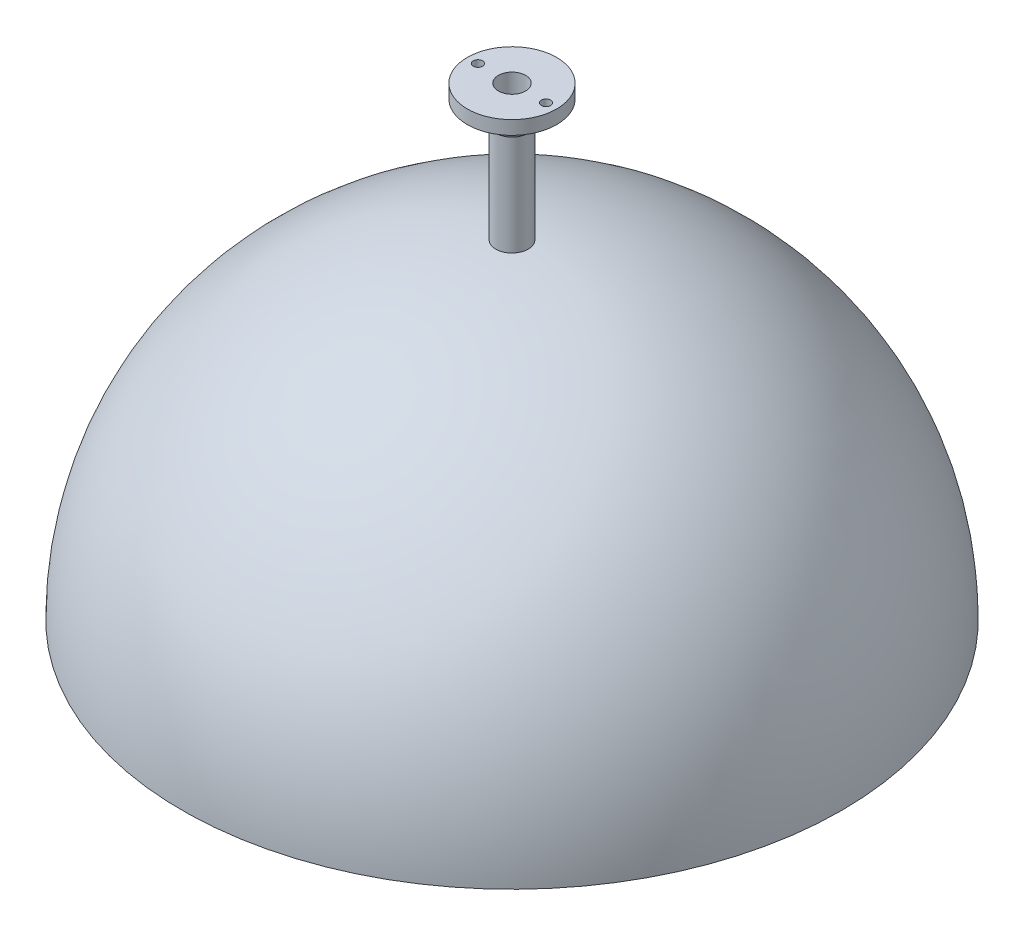
from build123d import *

# Parameters (mm, degrees)
CUT_EXTRUDE1_REACH = 1549.869
SKETCH3_R          = 11
SKETCH4_R          = 32
CUT_EXTRUDE2_DEPTH = 500


with BuildPart() as part:
    # Sketch1 → Revolve1 (revolve)
    with BuildSketch(Plane.XY):
        with BuildLine():
            Line((0, 759), (0, 775))
            ThreePointArc((0, 775), (548.00775542, 548.00775542), (775, 0))
            Line((775, 0), (759, 0))
            ThreePointArc((759, 0), (536.694046921, 536.694046921), (0, 759))
        make_face()
    revolve(axis=Axis((0, 0, 0), (0, 1, 0)))

    # Sketch2 → Revolve2 (revolve)
    with BuildSketch(Plane.XY):
        Polygon((105, 1093), (105, 1061), (52.624014674, 1061), (38, 1010), (38, 774.067826486), (32, 774.067826486), (32, 1093), align=None)
    revolve(axis=Axis((0, 775, 0), (0, 1, 0)))

    # Sketch3 → Cut-Extrude1 (cut, up to next)
    with BuildSketch(Plane(origin=(0, 1093, 0), x_dir=(1, 0, 0), z_dir=(0, 1, 0)), mode=Mode.PRIVATE) as cut_extrude1_sk1:
        with Locations(Location((-80, 0, 0), (0, 0, 180))):
            Circle(SKETCH3_R)
    cut_extrude1_tool1 = extrude(cut_extrude1_sk1.sketch, amount=-CUT_EXTRUDE1_REACH, mode=Mode.PRIVATE) & part.part
    # Sketch3 → Cut-Extrude1 (cut, up to next)
    with BuildSketch(Plane(origin=(0, 1093, 0), x_dir=(1, 0, 0), z_dir=(0, 1, 0)), mode=Mode.PRIVATE) as cut_extrude1_sk2:
        with Locations(Location((80, 0, 0), (0, 0, 180))):
            Circle(SKETCH3_R)
    cut_extrude1_tool2 = extrude(cut_extrude1_sk2.sketch, amount=-CUT_EXTRUDE1_REACH, mode=Mode.PRIVATE) & part.part
    add(cut_extrude1_tool1.solids().sort_by_distance((-80, 1093, 0))[0], mode=Mode.SUBTRACT)
    add(cut_extrude1_tool2.solids().sort_by_distance((80, 1093, 0))[0], mode=Mode.SUBTRACT)

    # Sketch4 → Cut-Extrude2 (cut)
    with BuildSketch(Plane(origin=(0, 1093, 0), x_dir=(1, 0, 0), z_dir=(0, 1, 0))):
        Circle(SKETCH4_R)
    extrude(amount=-CUT_EXTRUDE2_DEPTH, mode=Mode.SUBTRACT)


solid = part.part
